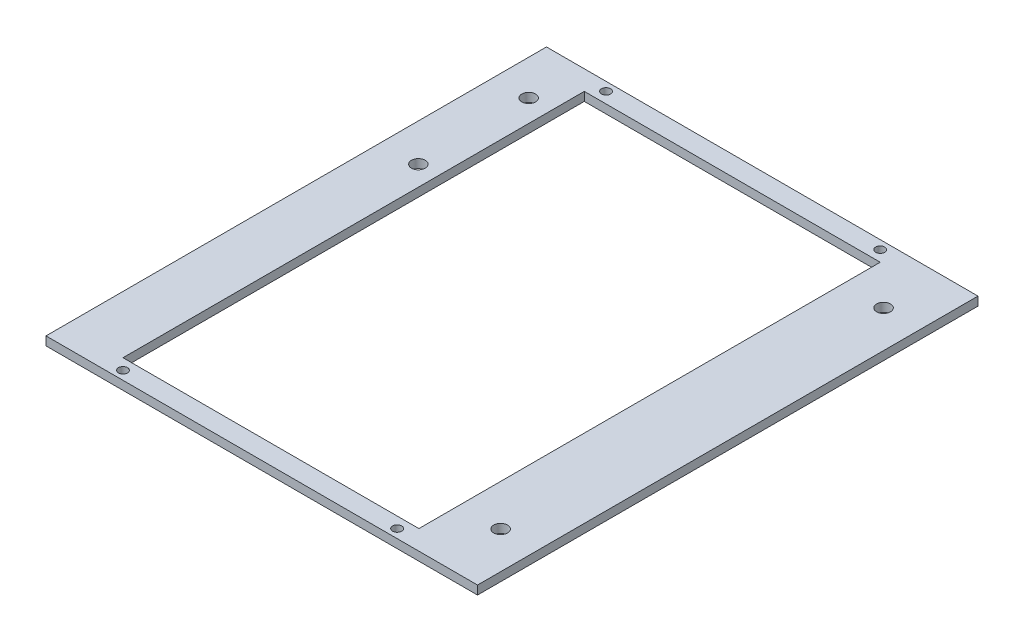
from build123d import *

# Parameters (mm, degrees)
SKETCH_1_W      = 99.16
SKETCH_1_H      = 115
SKETCH_1_R      = 1.585
SKETCH_1_R_2    = 1.05
SKETCH_1_W_2    = 68
SKETCH_1_H_2    = 106
EXTRUDE_1_DEPTH = 2


with BuildPart() as part:
    # 草图1 → 凸台-拉伸1 (new body)
    with BuildSketch(Plane(origin=(0, 0, 0), x_dir=(1, 0, 0), z_dir=(0, 1, 0))):
        with Locations((49.58, -57.5)):
            Rectangle(SKETCH_1_W, SKETCH_1_H)
        with Locations(Location((90.66, -13.2, 0), (0, 0, 270))):
            Circle(SKETCH_1_R, mode=Mode.SUBTRACT)
        with Locations(Location((90.66, -101.2, 0), (0, 0, 270))):
            Circle(SKETCH_1_R, mode=Mode.SUBTRACT)
        with Locations(Location((8.12, -12.2, 0), (0, 0, 270))):
            Circle(SKETCH_1_R, mode=Mode.SUBTRACT)
        with Locations(Location((8.62, -38.06, 0), (0, 0, 270))):
            Circle(SKETCH_1_R, mode=Mode.SUBTRACT)
        with Locations(Location((15.69, -2, 0), (0, 0, 270))):
            Circle(SKETCH_1_R_2, mode=Mode.SUBTRACT)
        with Locations(Location((78.69, -2, 0), (0, 0, 270))):
            Circle(SKETCH_1_R_2, mode=Mode.SUBTRACT)
        with Locations(Location((15.69, -113, 0), (0, 0, 270))):
            Circle(SKETCH_1_R_2, mode=Mode.SUBTRACT)
        with Locations(Location((78.69, -113, 0), (0, 0, 270))):
            Circle(SKETCH_1_R_2, mode=Mode.SUBTRACT)
        with Locations((47.19, -57.5)):
            Rectangle(SKETCH_1_W_2, SKETCH_1_H_2, mode=Mode.SUBTRACT)
    extrude(amount=EXTRUDE_1_DEPTH)


solid = part.part
